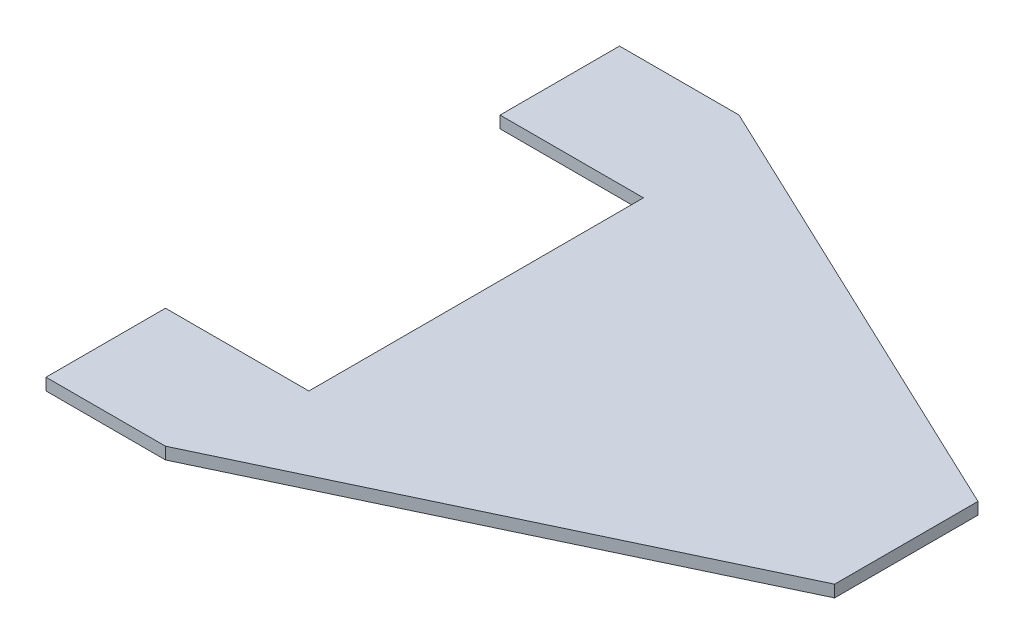
from build123d import *

# Parameters (mm, degrees)
BOSS_EXTRUDE1_DEPTH = 6.35


with BuildPart() as part:
    # Sketch1 → Boss-Extrude1 (new body)
    with BuildSketch(Plane(origin=(0, 0, 0), x_dir=(1, 0, 0), z_dir=(0, 1, 0))):
        Polygon((76.2, 88.9), (76.2, -88.9), (0, -88.9), (0, -152.4), (63.5, -152.4), (304.8, -38.1), (304.8, 38.1), (63.5, 152.4), (0, 152.4), (0, 88.9), align=None)
    extrude(amount=BOSS_EXTRUDE1_DEPTH)


solid = part.part
